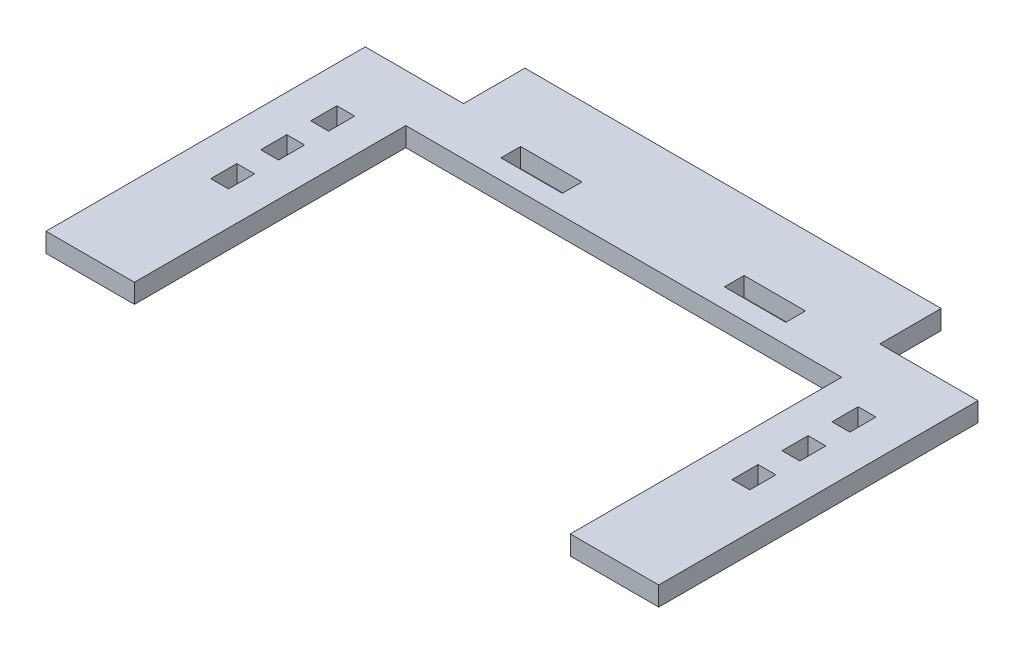
from build123d import *

# Parameters (mm, degrees)
SKETCH1_W           = 2.9
SKETCH1_H           = 4.25
SKETCH1_W_2         = 10
SKETCH1_H_2         = 3.2
BOSS_EXTRUDE1_DEPTH = 3.125
SKETCH3_W           = 71
SKETCH3_H           = 44.2
CUT_EXTRUDE1_DEPTH  = 3.125


with BuildPart() as part:
    # Sketch1 → Boss-Extrude1 (new body)
    with BuildSketch(Plane(origin=(0, 0, 0), x_dir=(1, 0, 0), z_dir=(0, 1, 0))):
        Polygon((-68.534526854, 15.117391304), (-52.534526854, 15.117391304), (-52.534526854, 25.117391304), (15.265473146, 25.117391304), (15.265473146, 15.117391304), (31.265473146, 15.117391304), (31.265473146, -36.882608696), (-68.534526854, -36.882608696), align=None)
        with Locations((-61.084526854, 2.367391304)):
            Rectangle(SKETCH1_W, SKETCH1_H, mode=Mode.SUBTRACT)
        with Locations((-61.084526854, -5.782608696)):
            Rectangle(SKETCH1_W, SKETCH1_H, mode=Mode.SUBTRACT)
        with Locations((-61.084526854, -13.932608696)):
            Rectangle(SKETCH1_W, SKETCH1_H, mode=Mode.SUBTRACT)
        with Locations((23.815473146, 2.367391304)):
            Rectangle(SKETCH1_W, SKETCH1_H, mode=Mode.SUBTRACT)
        with Locations((23.815473146, -5.782608696)):
            Rectangle(SKETCH1_W, SKETCH1_H, mode=Mode.SUBTRACT)
        with Locations((23.815473146, -13.932608696)):
            Rectangle(SKETCH1_W, SKETCH1_H, mode=Mode.SUBTRACT)
        with Locations((-36.834526854, 12.117391304)):
            Rectangle(SKETCH1_W_2, SKETCH1_H_2, mode=Mode.SUBTRACT)
        with Locations((-0.434526854, 12.117391304)):
            Rectangle(SKETCH1_W_2, SKETCH1_H_2, mode=Mode.SUBTRACT)
    extrude(amount=BOSS_EXTRUDE1_DEPTH)

    # Sketch3 → Cut-Extrude1 (cut)
    with BuildSketch(Plane(origin=(0, 3.125, 0), x_dir=(1, 0, 0), z_dir=(0, 1, 0))):
        with Locations((-18.634526854, -14.782608696)):
            Rectangle(SKETCH3_W, SKETCH3_H)
    extrude(amount=-CUT_EXTRUDE1_DEPTH, mode=Mode.SUBTRACT)


solid = part.part
